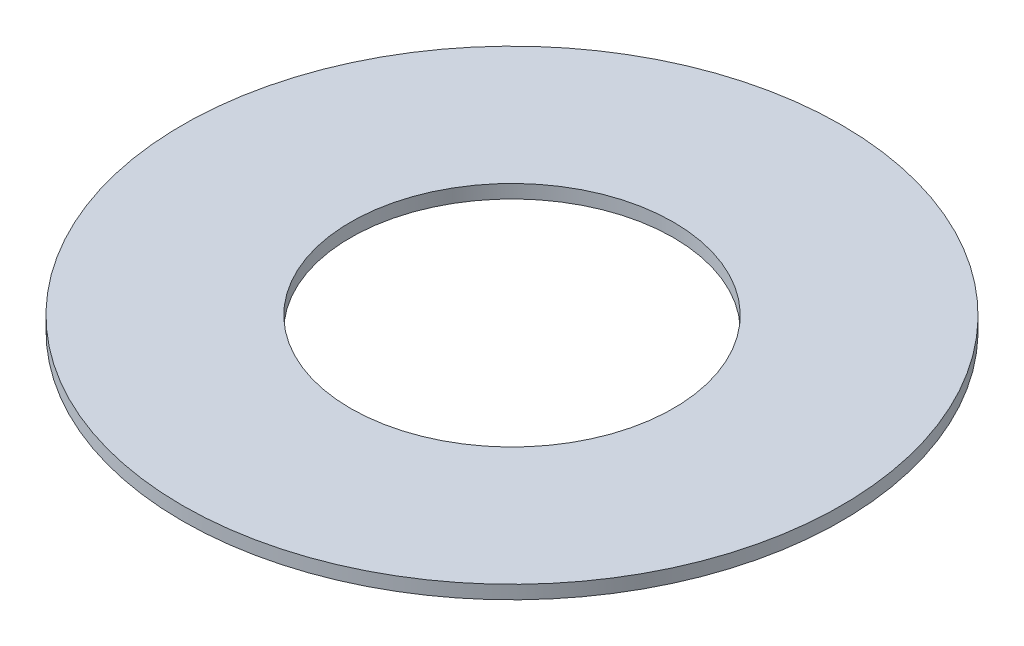
from build123d import *

# Parameters (mm, degrees)
SKETCH1_R           = 12.25
SKETCH1_R_2         = 6
BOSS_EXTRUDE1_DEPTH = 0.5


with BuildPart() as part:
    # Sketch1 → Boss-Extrude1 (new body)
    with BuildSketch(Plane(origin=(0, 0, 0), x_dir=(1, 0, 0), z_dir=(0, 1, 0))):
        with Locations(Location((0, 0, 0), (0, 0, 270))):
            Circle(SKETCH1_R)
        with Locations(Location((0, 0, 0), (0, 0, 270))):
            Circle(SKETCH1_R_2, mode=Mode.SUBTRACT)
    extrude(amount=BOSS_EXTRUDE1_DEPTH)


solid = part.part
